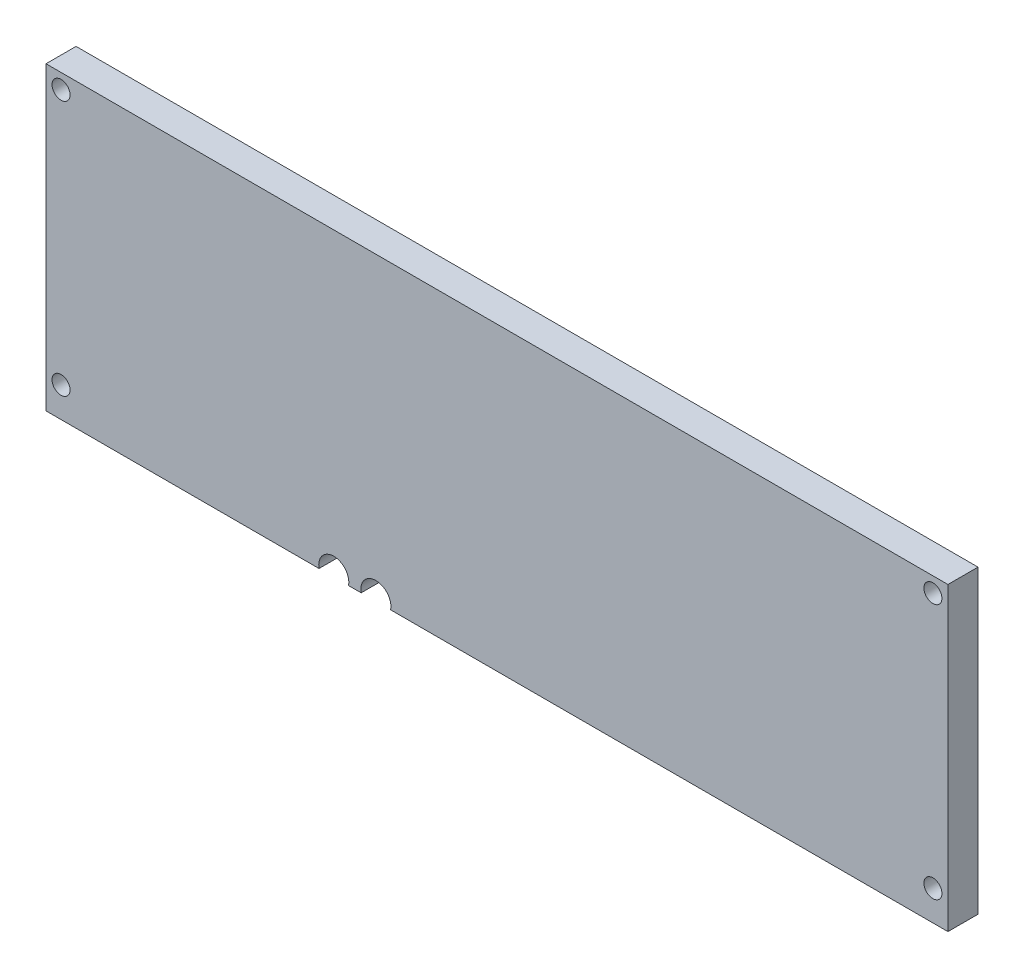
from build123d import *

# Parameters (mm, degrees)
SKETCH1_W           = 150
SKETCH1_H           = 50
BOSS_EXTRUDE1_DEPTH = 5
SKETCH2_R           = 1.5
CUT_EXTRUDE1_DEPTH  = 10
SKETCH3_R           = 2.5
CUT_EXTRUDE2_DEPTH  = 159.192920196


with BuildPart() as part:
    # Sketch1 → Boss-Extrude1 (new body)
    with BuildSketch(Plane.XY):
        with Locations((75, 25)):
            Rectangle(SKETCH1_W, SKETCH1_H)
    extrude(amount=BOSS_EXTRUDE1_DEPTH)

    # Sketch2 → Cut-Extrude1 (cut)
    with BuildSketch(Plane.XY.offset(5)):
        with Locations((2.5, 5)):
            Circle(SKETCH2_R)
        with Locations((2.5, 47.5)):
            Circle(SKETCH2_R)
        with Locations((147.5, 47.5)):
            Circle(SKETCH2_R)
        with Locations((147.5, 5)):
            Circle(SKETCH2_R)
    extrude(amount=-CUT_EXTRUDE1_DEPTH, mode=Mode.SUBTRACT)

    # Sketch3 → Cut-Extrude2 (cut, through all)
    with BuildSketch(Plane(origin=(0, 0, 0), x_dir=(-1, 0, 0), z_dir=(0, 0, -1))):
        with Locations((-54.86063832, 0.5)):
            Circle(SKETCH3_R)
        with Locations((-47.857694484, 0.5)):
            Circle(SKETCH3_R)
    extrude(amount=-CUT_EXTRUDE2_DEPTH, mode=Mode.SUBTRACT)


solid = part.part
